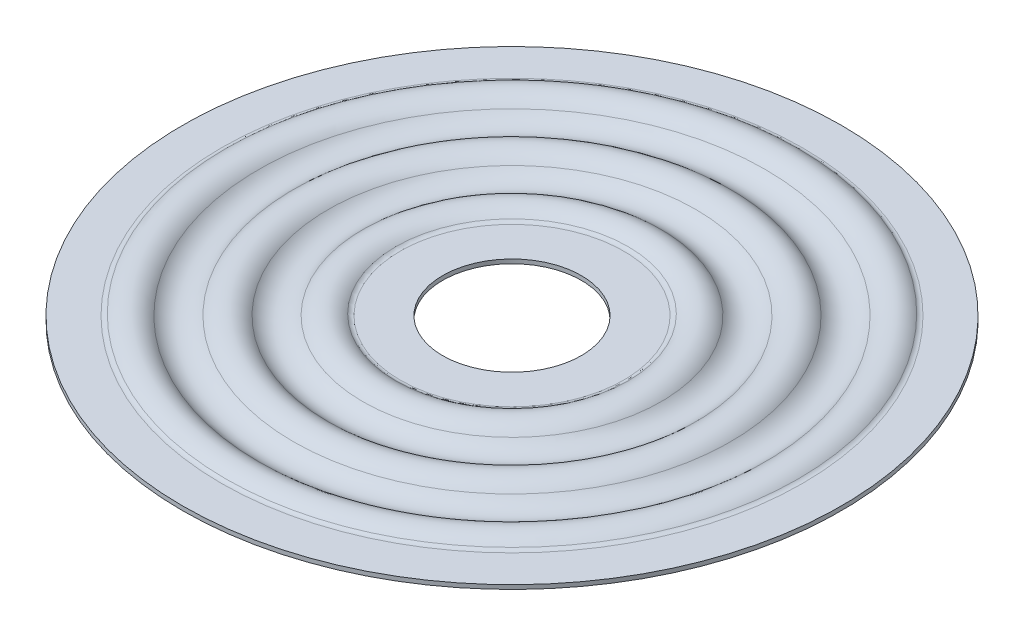
from build123d import *

# Parameters (mm, degrees)
FILLET_1_R = 1
SHELL_1_T  = -0.6


with BuildPart() as part:
    # Эскиз1 → Повернуть1 (revolve)
    with BuildSketch(Plane.XY, mode=Mode.PRIVATE) as revolve_1_sk:
        with BuildLine():
            Line((-10, 0), (-47.5, 0))
            Line((-47.5, 0), (-47.5, 10))
            Line((-47.5, 10), (-41.5, 10))
            ThreePointArc((-41.5, 10), (-39, 11.050510257), (-36.5, 10))
            ThreePointArc((-36.5, 10), (-34, 8.949489743), (-31.5, 10))
            ThreePointArc((-31.5, 10), (-29, 11.050510257), (-26.5, 10))
            ThreePointArc((-26.5, 10), (-24, 8.949489743), (-21.5, 10))
            ThreePointArc((-21.5, 10), (-19, 11.050510257), (-16.5, 10))
            Line((-16.5, 10), (-10, 10))
            Line((-10, 10), (-10, 0))
        make_face()
    revolve(revolve_1_sk.sketch.rotate(Axis((0, 10, 0), (0, -1, 0)), 270), axis=Axis((0, 10, 0), (0, -1, 0)))

    # Скругление1
    fillet_1_edges = [part.edges().sort_by_distance(p)[0] for p in [
        (0, 10, -41.5),
        (0, 10, -16.5),
    ]]
    fillet(fillet_1_edges, radius=FILLET_1_R)

    # Оболочка1
    shell_1_openings = [part.faces().sort_by_distance(p)[0] for p in [
        (0, 5, -47.5),
        (0, 0, -11.343502884),
        (0, 5, -10),
    ]]
    offset(amount=SHELL_1_T, openings=shell_1_openings, kind=Kind.INTERSECTION)


solid = part.part
